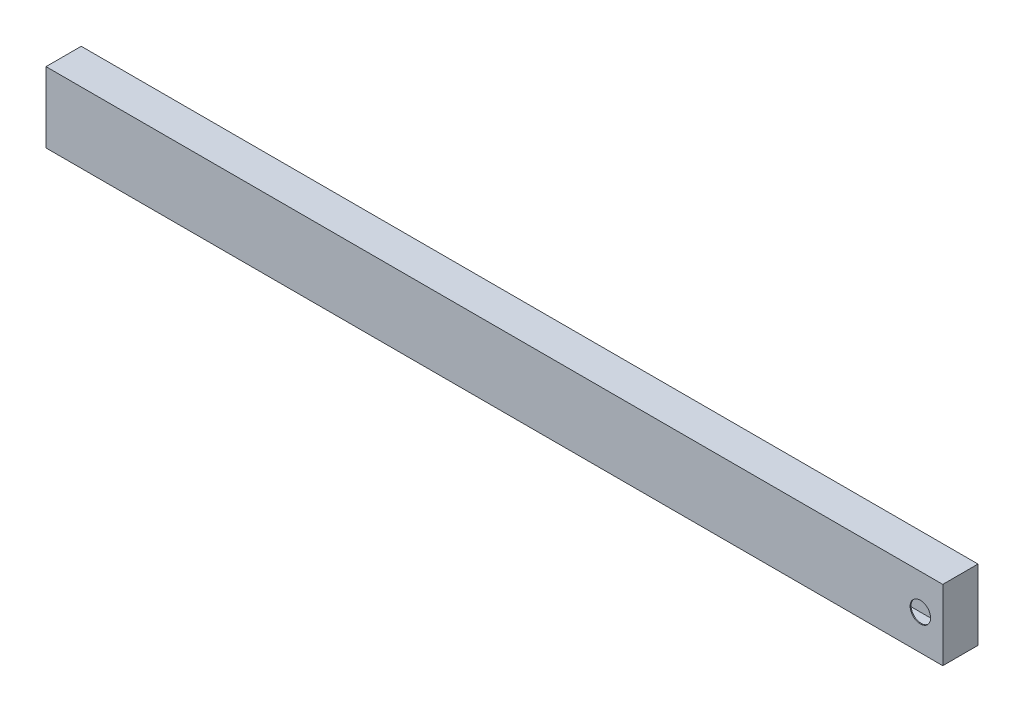
from build123d import *

# Parameters (mm, degrees)
SKETCH_1_W          = 1400
SKETCH_1_H          = 55
EXTRUDE_1_DEPTH     = 110
SKETCH_3_R          = 30
SKETCH_3_R_2        = 2.5
CUT_EXTRUDE_1_DEPTH = 10
CUT_EXTRUDE_START   = -3
SKETCH_4_W          = 52
SKETCH_4_H          = 107
CUT_EXTRUDE_2_DEPTH = 1394
SKETCH_5_R          = 16
CUT_EXTRUDE_3_DEPTH = 10


with BuildPart() as part:
    # Эскиз1 → Бобышка-Вытянуть1 (new body)
    with BuildSketch(Plane(origin=(0, 0, 0), x_dir=(1, 0, 0), z_dir=(0, 1, 0))):
        with Locations((-700, 27.5)):
            Rectangle(SKETCH_1_W, SKETCH_1_H)
    extrude(amount=EXTRUDE_1_DEPTH)

    # Эскиз3 → Вырез-Вытянуть1 (cut)
    with BuildSketch(Plane(origin=(0, 0, -55), x_dir=(-1, 0, 0), z_dir=(0, 0, -1))):
        with Locations((120, 55)):
            Circle(SKETCH_3_R)
        with Locations((225, 55)):
            Circle(SKETCH_3_R)
        with Locations((330, 55)):
            Circle(SKETCH_3_R)
        with Locations((435, 55)):
            Circle(SKETCH_3_R)
        with Locations((540, 55)):
            Circle(SKETCH_3_R)
        with Locations((645, 55)):
            Circle(SKETCH_3_R)
        with Locations((750, 55)):
            Circle(SKETCH_3_R)
        with Locations((855, 55)):
            Circle(SKETCH_3_R)
        with Locations((960, 55)):
            Circle(SKETCH_3_R)
        with Locations((1380, 55)):
            Circle(SKETCH_3_R_2)
        with Locations((1065, 55)):
            Circle(SKETCH_3_R)
        with Locations((1170, 55)):
            Circle(SKETCH_3_R)
        with Locations((1275, 55)):
            Circle(SKETCH_3_R)
    extrude(amount=-CUT_EXTRUDE_1_DEPTH, mode=Mode.SUBTRACT)

    # Эскиз4 → Вырез-Вытянуть2 (cut)
    with BuildSketch(Plane(origin=(0, 0, 0), x_dir=(0, 0, -1), z_dir=(1, 0, 0)).offset(CUT_EXTRUDE_START)):
        with Locations((27.5, 55)):
            Rectangle(SKETCH_4_W, SKETCH_4_H)
    extrude(amount=-CUT_EXTRUDE_2_DEPTH, mode=Mode.SUBTRACT)

    # Эскиз5 → Вырез-Вытянуть3 (cut)
    with BuildSketch(Plane.XY):
        with Locations((-35, 55)):
            Circle(SKETCH_5_R)
    extrude(amount=-CUT_EXTRUDE_3_DEPTH, mode=Mode.SUBTRACT)


solid = part.part
